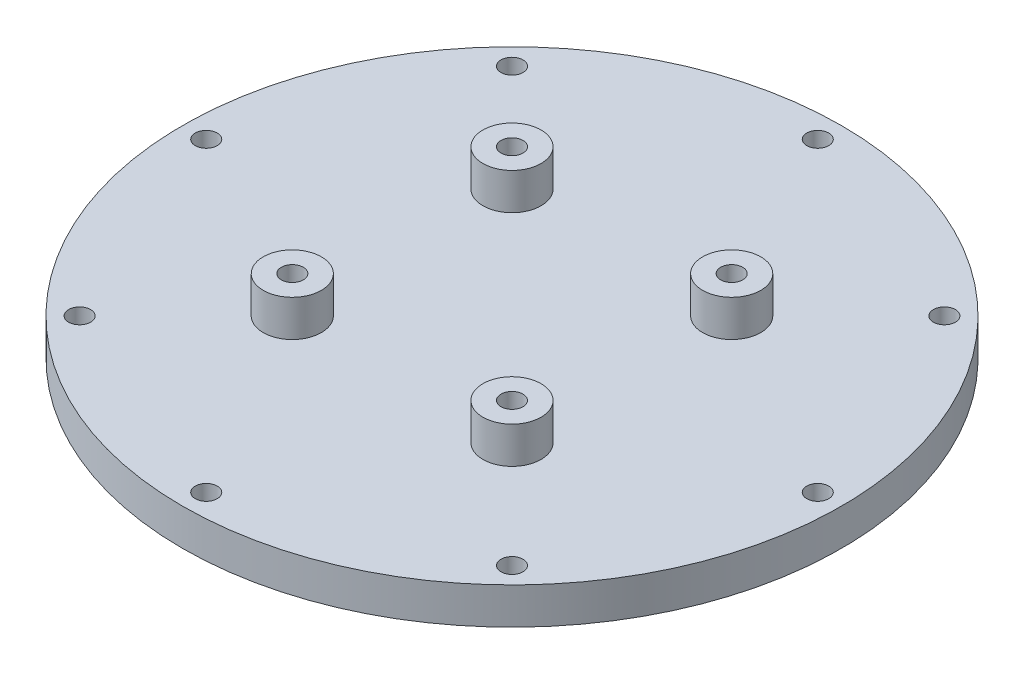
from build123d import *

# Parameters (mm, degrees)
SKETCH1_R               = 45
SKETCH1_R_2             = 1.5
BOSS_EXTRUDE2_DEPTH     = 5
SKETCH2_R               = 3.96875
BOSS_EXTRUDE3_DEPTH     = 5
SKETCH3_R               = 1.5
CUT_EXTRUDE1_DEPTH      = 7
CUT_EXTRUDE2_DEPTH      = 27
CUT_EXTRUDE2_DEPTH_BACK = 19
SKETCH4_W               = 27.9375
SKETCH4_H               = 5
SKETCH5_W               = 38.057412374
SKETCH5_H               = 36.402742271
BOSS_EXTRUDE4_DEPTH     = 4
SKETCH6_R               = 3.96875
SKETCH6_R_2             = 1.5
BOSS_EXTRUDE5_DEPTH     = 5
CUT_EXTRUDE3_START      = -2
SKETCH6_2_R             = 1.5
CUT_EXTRUDE3_DEPTH      = 2


with BuildPart() as part:
    # Sketch1 → Boss-Extrude2 (new body)
    with BuildSketch(Plane(origin=(0, 0, 0), x_dir=(1, 0, 0), z_dir=(0, 1, 0))):
        Circle(SKETCH1_R)
        with Locations((0, 41.75)):
            Circle(SKETCH1_R_2, mode=Mode.SUBTRACT)
        with Locations((29.521708115, 29.521708115)):
            Circle(SKETCH1_R_2, mode=Mode.SUBTRACT)
        with Locations((41.75, 0)):
            Circle(SKETCH1_R_2, mode=Mode.SUBTRACT)
        with Locations((29.521708115, -29.521708115)):
            Circle(SKETCH1_R_2, mode=Mode.SUBTRACT)
        with Locations((0, -41.75)):
            Circle(SKETCH1_R_2, mode=Mode.SUBTRACT)
        with Locations((-29.521708115, -29.521708115)):
            Circle(SKETCH1_R_2, mode=Mode.SUBTRACT)
        with Locations((-41.75, 0)):
            Circle(SKETCH1_R_2, mode=Mode.SUBTRACT)
        with Locations((-29.521708115, 29.521708115)):
            Circle(SKETCH1_R_2, mode=Mode.SUBTRACT)
    extrude(amount=BOSS_EXTRUDE2_DEPTH)

    # Sketch2 → Boss-Extrude3 (add)
    with BuildSketch(Plane(origin=(0, 5, 0), x_dir=(1, 0, 0), z_dir=(0, 1, 0))):
        with Locations((-10, 10)):
            Circle(SKETCH2_R)
        with Locations((10, 10)):
            Circle(SKETCH2_R)
        with Locations((10, -10)):
            Circle(SKETCH2_R)
        with Locations((-10, -10)):
            Circle(SKETCH2_R)
    extrude(amount=BOSS_EXTRUDE3_DEPTH)

    # Sketch3 → Cut-Extrude1 (cut)
    with BuildSketch(Plane(origin=(0, 10, 0), x_dir=(1, 0, 0), z_dir=(0, 1, 0))):
        with Locations((-10, 10)):
            Circle(SKETCH3_R)
        with Locations((10, 10)):
            Circle(SKETCH3_R)
        with Locations((-10, -10)):
            Circle(SKETCH3_R)
        with Locations((10, -10)):
            Circle(SKETCH3_R)
    extrude(amount=-CUT_EXTRUDE1_DEPTH, mode=Mode.SUBTRACT)

    # Sketch4 → Cut-Extrude2 (cut, two sides: drawn at the far end of the back side and taken through both)
    with BuildSketch(Plane.XY.offset(-CUT_EXTRUDE2_DEPTH_BACK)):
        with Locations((0, 7.5)):
            Rectangle(SKETCH4_W, SKETCH4_H)
    extrude(amount=CUT_EXTRUDE2_DEPTH + CUT_EXTRUDE2_DEPTH_BACK, mode=Mode.SUBTRACT)

    # Sketch5 → Boss-Extrude4 (add)
    with BuildSketch(Plane(origin=(0, 5, 0), x_dir=(1, 0, 0), z_dir=(0, 1, 0))):
        with Locations((0.472762887, -0.413667525)):
            Rectangle(SKETCH5_W, SKETCH5_H)
    extrude(amount=-BOSS_EXTRUDE4_DEPTH)

    # Sketch6 → Boss-Extrude5 (add)
    # profile 1 of 4: a face of its own
    with BuildSketch(Plane(origin=(0, 5, 0), x_dir=(1, 0, 0), z_dir=(0, 1, 0))):
        with Locations((-15, 15)):
            Circle(SKETCH6_R)
        with Locations((-15, 15)):
            Circle(SKETCH6_R_2, mode=Mode.SUBTRACT)
    # profile 2 of 4: a face of its own
    with BuildSketch(Plane(origin=(0, 5, 0), x_dir=(1, 0, 0), z_dir=(0, 1, 0))):
        with Locations((15, 15)):
            Circle(SKETCH6_R)
        with Locations((15, 15)):
            Circle(SKETCH6_R_2, mode=Mode.SUBTRACT)
    # profile 3 of 4: a face of its own
    with BuildSketch(Plane(origin=(0, 5, 0), x_dir=(1, 0, 0), z_dir=(0, 1, 0))):
        with Locations((15, -15)):
            Circle(SKETCH6_R)
        with Locations((15, -15)):
            Circle(SKETCH6_R_2, mode=Mode.SUBTRACT)
    # profile 4 of 4: a face of its own
    with BuildSketch(Plane(origin=(0, 5, 0), x_dir=(1, 0, 0), z_dir=(0, 1, 0))):
        with Locations((-15, -15)):
            Circle(SKETCH6_R)
        with Locations((-15, -15)):
            Circle(SKETCH6_R_2, mode=Mode.SUBTRACT)
    extrude(amount=BOSS_EXTRUDE5_DEPTH)

    # Sketch6<2> → Cut-Extrude3 (cut)
    with BuildSketch(Plane(origin=(0, 5, 0), x_dir=(1, 0, 0), z_dir=(0, 1, 0)).offset(CUT_EXTRUDE3_START)):
        with Locations((-15, 15)):
            Circle(SKETCH6_2_R)
        with Locations((15, 15)):
            Circle(SKETCH6_2_R)
        with Locations((15, -15)):
            Circle(SKETCH6_2_R)
        with Locations((-15, -15)):
            Circle(SKETCH6_2_R)
    extrude(amount=CUT_EXTRUDE3_DEPTH, mode=Mode.SUBTRACT)


solid = part.part
